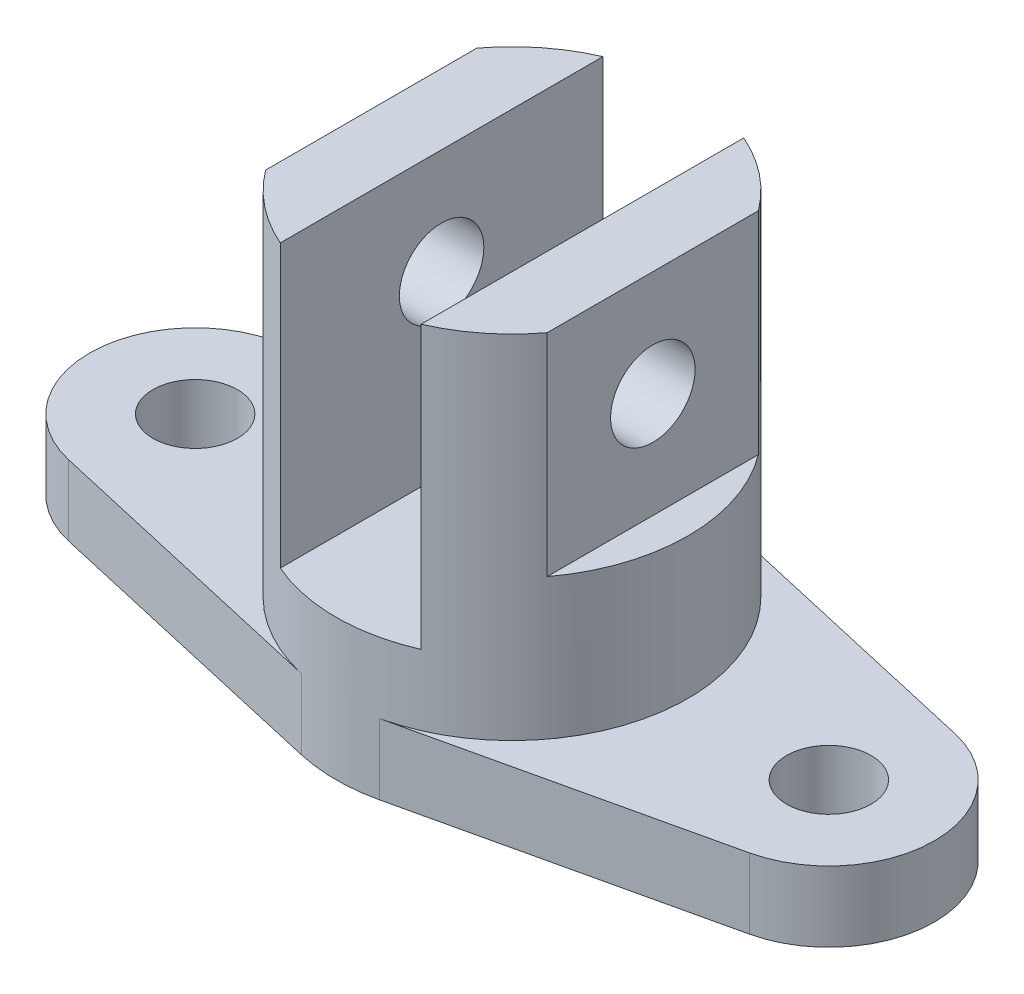
from build123d import *

# Parameters (mm, degrees)
CROQUIS1_R                 = 6
SALIENTE_EXTRUIR1_DEPTH    = 10
SALIENTE_EXTRUIR1_2_DEPTH  = 10
SALIENTE_EXTRUIR2_DEPTH    = 60
CROQUIS2_W                 = 20
CROQUIS2_H                 = 56.632535906
CORTAR_EXTRUIR2_DEPTH      = 40
CROQUIS3_W                 = 5
CROQUIS3_H                 = 50
CORTAR_EXTRUIR3_DEPTH      = 30
CORTAR_EXTRUIR4_DEPTH      = 104.07764064
CORTAR_EXTRUIR4_DEPTH_BACK = 104.07764064
CROQUIS5_R                 = 6


with BuildPart() as part:
    # Croquis1 → Saliente-Extruir1 (new body)
    with BuildSketch(Plane(origin=(0, 0, 0), x_dir=(1, 0, 0), z_dir=(0, 1, 0))):
        with BuildLine():
            Line((-5.555555556, 24.374901076), (-48.333333333, 14.624940646))
            ThreePointArc((-48.333333333, 14.624940646), (-60, 0), (-48.333333333, -14.624940646))
            Line((-48.333333333, -14.624940646), (-5.555555556, -24.374901076))
            ThreePointArc((-5.555555556, -24.374901076), (-25, 0), (-5.555555556, 24.374901076))
        make_face()
        with Locations((-45, 0)):
            Circle(CROQUIS1_R, mode=Mode.SUBTRACT)
    extrude(amount=SALIENTE_EXTRUIR1_DEPTH)



with BuildPart() as body_2:
    # Croquis1 → Saliente-Extruir1 2 (new body)
    with BuildSketch(Plane(origin=(0, 0, 0), x_dir=(1, 0, 0), z_dir=(0, 1, 0))):
        with BuildLine():
            Line((48.333333333, 14.624940646), (5.555555556, 24.374901076))
            ThreePointArc((5.555555556, 24.374901076), (25, 0), (5.555555556, -24.374901076))
            Line((5.555555556, -24.374901076), (48.333333333, -14.624940646))
            ThreePointArc((48.333333333, -14.624940646), (60, 0), (48.333333333, 14.624940646))
        make_face()
        with Locations((45, 0)):
            Circle(CROQUIS1_R, mode=Mode.SUBTRACT)
    extrude(amount=SALIENTE_EXTRUIR1_2_DEPTH)


with BuildPart() as part_1:
    add(part.part)

    add(body_2.part)  # Saliente-Extruir2 merges body 2
    # Croquis1<4> → Saliente-Extruir2 (add)
    with BuildSketch(Plane(origin=(0, 0, 0), x_dir=(1, 0, 0), z_dir=(0, 1, 0))):
        with BuildLine():
            ThreePointArc((5.555555556, 24.374901076), (0, 25), (-5.555555556, 24.374901076))
            ThreePointArc((-5.555555556, 24.374901076), (-25, 0), (-5.555555556, -24.374901076))
            ThreePointArc((-5.555555556, -24.374901076), (0, -25), (5.555555556, -24.374901076))
            ThreePointArc((5.555555556, -24.374901076), (19.543398999, -15.590239112), (25, 0))
            ThreePointArc((25, 0), (19.543398999, 15.590239112), (5.555555556, 24.374901076))
        make_face()
    extrude(amount=SALIENTE_EXTRUIR2_DEPTH)

    # Croquis2 → Cortar-Extruir2 (cut)
    with BuildSketch(Plane(origin=(0, 60, 0), x_dir=(1, 0, 0), z_dir=(0, 1, 0))):
        Rectangle(CROQUIS2_W, CROQUIS2_H)
    extrude(amount=-CORTAR_EXTRUIR2_DEPTH, mode=Mode.SUBTRACT)

    # Croquis3 → Cortar-Extruir3 (cut)
    with BuildSketch(Plane(origin=(0, 60, 0), x_dir=(1, 0, 0), z_dir=(0, 1, 0))):
        with Locations((-22.5, 0)):
            Rectangle(CROQUIS3_W, CROQUIS3_H)
        with Locations((22.5, 0)):
            Rectangle(CROQUIS3_W, CROQUIS3_H)
    extrude(amount=-CORTAR_EXTRUIR3_DEPTH, mode=Mode.SUBTRACT)

    # Croquis5 → Cortar-Extruir4 (cut, two sides: drawn at the far end of the back side and taken through both)
    with BuildSketch(Plane(origin=(20, 0, 0), x_dir=(0, 0, -1), z_dir=(1, 0, 0)).offset(-CORTAR_EXTRUIR4_DEPTH_BACK)):
        with Locations((0, 45)):
            Circle(CROQUIS5_R)
    extrude(amount=CORTAR_EXTRUIR4_DEPTH + CORTAR_EXTRUIR4_DEPTH_BACK, mode=Mode.SUBTRACT)


solid = part_1.part
